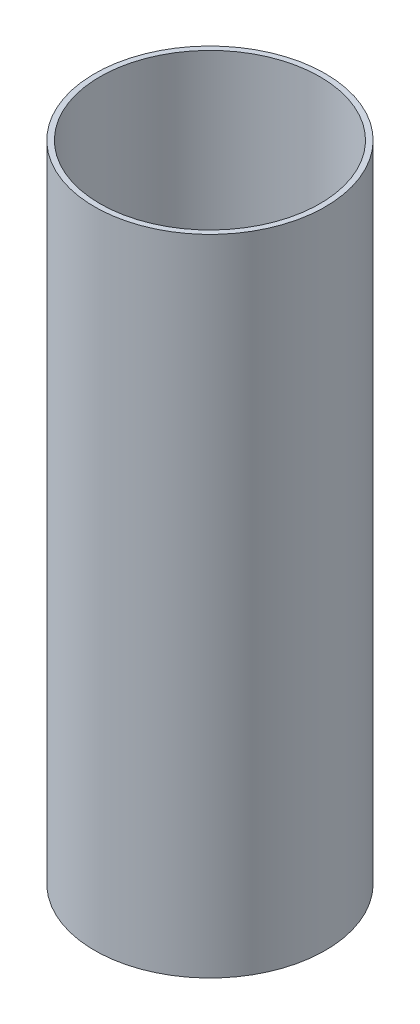
from build123d import *


with BuildPart() as part:
    # Sketch1 → Revolve1 (revolve)
    with BuildSketch(Plane.XY, mode=Mode.PRIVATE) as revolve1_sk:
        Polygon((34.13125, 190.5), (34.13125, 0), (0, 0), (0, 1.5875), (32.54375, 1.5875), (32.54375, 190.5), align=None)
    revolve(revolve1_sk.sketch.rotate(Axis((0, 0, 0), (0, 1, 0)), 90), axis=Axis((0, 0, 0), (0, 1, 0)))


solid = part.part
